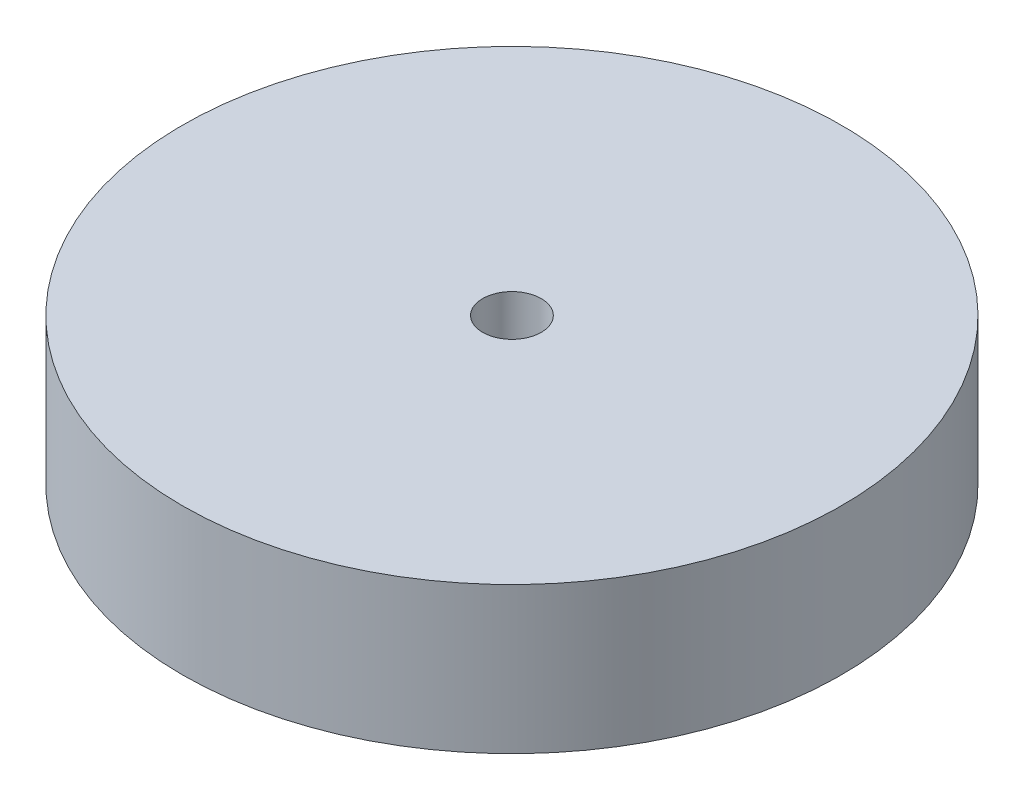
from build123d import *

# Parameters (mm, degrees)
SKETCH1_R           = 45
BOSS_EXTRUDE1_DEPTH = 20
CUT_EXTRUDE1_REACH  = 68.708
SKETCH2_R           = 4


with BuildPart() as part:
    # Sketch1 → Boss-Extrude1 (new body)
    with BuildSketch(Plane(origin=(0, 0, 0), x_dir=(1, 0, 0), z_dir=(0, 1, 0))):
        with Locations(Location((0, 0, 0), (0, 0, 270))):
            Circle(SKETCH1_R)
    extrude(amount=BOSS_EXTRUDE1_DEPTH)

    # Sketch2 → Cut-Extrude1 (cut, up to next)
    with BuildSketch(Plane(origin=(0, 20, 0), x_dir=(1, 0, 0), z_dir=(0, 1, 0)), mode=Mode.PRIVATE) as cut_extrude1_sk1:
        with Locations(Location((0, 0, 0), (0, 0, 270))):
            Circle(SKETCH2_R)
    cut_extrude1_tool1 = extrude(cut_extrude1_sk1.sketch, amount=-CUT_EXTRUDE1_REACH, mode=Mode.PRIVATE) & part.part
    add(cut_extrude1_tool1.solids().sort_by_distance((0, 20, 0))[0], mode=Mode.SUBTRACT)


solid = part.part
